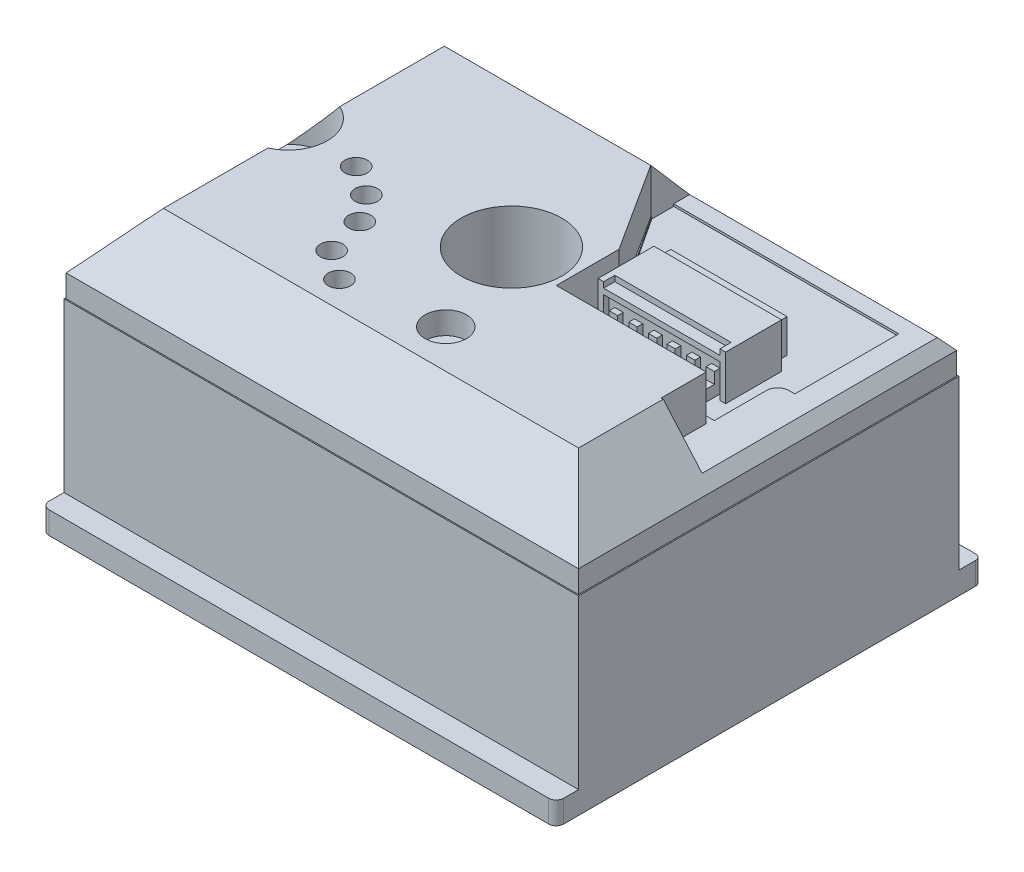
from build123d import *
from OCP.BRepFilletAPI import BRepFilletAPI_MakeChamfer

# Parameters (mm, degrees)
SKETCH1_W           = 46
SKETCH1_H           = 34
SKETCH1_R           = 4.5
BOSS_EXTRUDE1_DEPTH = 17
SKETCH2_W           = 45.8
SKETCH2_H           = 33.8
BOSS_EXTRUDE2_DEPTH = 2
SKETCH3_W           = 45.8
SKETCH3_H           = 33.8
BOSS_EXTRUDE3_DEPTH = 5
CHAMFER1_SIZE       = 5
CHAMFER1_SIZE2      = 4.346433689
SKETCH5_R           = 4.5
CUT_EXTRUDE1_DEPTH  = 63.032249677
CUT_EXTRUDE2_DEPTH  = 4
CUT_EXTRUDE3_DEPTH  = 4.5
CUT_EXTRUDE4_DEPTH  = 0.2
SKETCH11_W          = 11.4
SKETCH11_H          = 5
BOSS_EXTRUDE4_DEPTH = 4
SKETCH12_W          = 10.4
SKETCH12_H          = 1
CUT_EXTRUDE5_DEPTH  = 0.5
SKETCH13_W          = 10.4
SKETCH13_H          = 3
CUT_EXTRUDE6_DEPTH  = 0.5
SKETCH14_W          = 0.75
SKETCH14_H          = 2
BOSS_EXTRUDE5_DEPTH = 0.5
SKETCH15_W          = 0.75
SKETCH15_H          = 1
BOSS_EXTRUDE6_DEPTH = 1
SKETCH16_W          = 10.4
SKETCH16_H          = 3
BOSS_EXTRUDE7_DEPTH = 1
CUT_EXTRUDE7_DEPTH  = 1
SKETCH19_R          = 1
CUT_EXTRUDE8_DEPTH  = 2
SKETCH20_R          = 1.848835828
CUT_EXTRUDE9_DEPTH  = 2
BOSS_EXTRUDE8_DEPTH = 2
BOSS_EXTRUDE9_DEPTH = 2


with BuildPart() as part:
    # Sketch1 → Boss-Extrude1 (new body)
    with BuildSketch(Plane(origin=(0, 0, 0), x_dir=(1, 0, 0), z_dir=(0, 1, 0))):
        with Locations((23, 17)):
            Rectangle(SKETCH1_W, SKETCH1_H)
        with Locations(Location((23, 17, 0), (0, 0, 270))):
            Circle(SKETCH1_R, mode=Mode.SUBTRACT)
    extrude(amount=BOSS_EXTRUDE1_DEPTH)

    # Sketch2 → Boss-Extrude2 (add)
    with BuildSketch(Plane(origin=(0, 17, 0), x_dir=(1, 0, 0), z_dir=(0, 1, 0))):
        with Locations((23, 17)):
            Rectangle(SKETCH2_W, SKETCH2_H)
    extrude(amount=BOSS_EXTRUDE2_DEPTH)

    # Sketch3 → Boss-Extrude3 (add)
    with BuildSketch(Plane(origin=(0, 19, 0), x_dir=(1, 0, 0), z_dir=(0, 1, 0))):
        with Locations((23, 17)):
            Rectangle(SKETCH3_W, SKETCH3_H)
    extrude(amount=BOSS_EXTRUDE3_DEPTH)

    # Chamfer1: one chamfer whose edges measure the first distance from different faces: ONE call of the kernel's chamfer builder (chamfer() names one face for all edges)
    chamfer1_edges_1 = [part.edges().sort_by_distance(p)[0] for p in [
        (23, 24, -33.9),
    ]]
    chamfer1_side_1 = [part.faces().sort_by_distance(p)[0] for p in [
        (23, 20.5, -33.9),
    ]]
    chamfer1_edges_2 = [part.edges().sort_by_distance(p)[0] for p in [
        (0.1, 24, -17),
    ]]
    chamfer1_side_2 = [part.faces().sort_by_distance(p)[0] for p in [
        (0.1, 20.5, -17),
    ]]
    chamfer1_edges_3 = [part.edges().sort_by_distance(p)[0] for p in [
        (23, 24, -0.1),
    ]]
    chamfer1_side_3 = [part.faces().sort_by_distance(p)[0] for p in [
        (23, 20.5, -0.1),
    ]]
    chamfer1_edges_4 = [part.edges().sort_by_distance(p)[0] for p in [
        (45.9, 24, -17),
    ]]
    chamfer1_side_4 = [part.faces().sort_by_distance(p)[0] for p in [
        (45.9, 20.5, -17),
    ]]
    chamfer1 = BRepFilletAPI_MakeChamfer(part.part.solid().wrapped)
    for e in chamfer1_edges_1:
        chamfer1.Add(CHAMFER1_SIZE, CHAMFER1_SIZE2, e.wrapped, chamfer1_side_1[0].wrapped)  # the first distance lies on this face
    for e in chamfer1_edges_2:
        chamfer1.Add(CHAMFER1_SIZE, CHAMFER1_SIZE2, e.wrapped, chamfer1_side_2[0].wrapped)  # the first distance lies on this face
    for e in chamfer1_edges_3:
        chamfer1.Add(CHAMFER1_SIZE, CHAMFER1_SIZE2, e.wrapped, chamfer1_side_3[0].wrapped)  # the first distance lies on this face
    for e in chamfer1_edges_4:
        chamfer1.Add(CHAMFER1_SIZE, CHAMFER1_SIZE2, e.wrapped, chamfer1_side_4[0].wrapped)  # the first distance lies on this face
    add(Compound.cast(chamfer1.Shape()), mode=Mode.REPLACE)

    # Sketch5 → Cut-Extrude1 (cut, through all)
    with BuildSketch(Plane(origin=(0, 24, 0), x_dir=(1, 0, 0), z_dir=(0, 1, 0))):
        with Locations(Location((23, 17, 0), (0, 0, 270))):
            Circle(SKETCH5_R)
    extrude(amount=-CUT_EXTRUDE1_DEPTH, mode=Mode.SUBTRACT)

    # Sketch7 → Cut-Extrude2 (cut)
    with BuildSketch(Plane(origin=(0, 24, 0), x_dir=(1, 0, 0), z_dir=(0, 1, 0))):
        Polygon((41.375862069, 12.011652794), (41.553566311, 12.011652794), (41.553566311, 29.553566311), (22.9, 29.553566311), (27.975862069, 21.638287753), (27.975862069, 16.037336504), (41.375862069, 16.037336504), align=None)
        Polygon((45.9, 12.011652794), (45.9, 33.9), (22.9, 34), (22.9, 29.553566311), (41.553566311, 29.553566311), (41.553566311, 12.011652794), align=None)
    extrude(amount=-CUT_EXTRUDE2_DEPTH, mode=Mode.SUBTRACT)

    # Sketch9 → Cut-Extrude3 (cut)
    with BuildSketch(Plane(origin=(0, 24, 0), x_dir=(1, 0, 0), z_dir=(0, 1, 0))):
        with BuildLine():
            Line((0.1, 17), (0.1, 15.1))
            ThreePointArc((0.1, 15.1), (4.029878247, 13.643077531), (6.539387691, 17))
            Line((6.539387691, 17), (0.1, 17))
        make_face()
        with BuildLine():
            Line((0.1, 18.9), (0.1, 17))
            Line((0.1, 17), (6.539387691, 17))
            ThreePointArc((6.539387691, 17), (4.029878247, 20.356922469), (0.1, 18.9))
        make_face()
        with BuildLine():
            Line((0.1, 17), (0.1, 15.1))
            ThreePointArc((0.1, 15.1), (4.029878247, 13.643077531), (6.539387691, 17))
            Line((6.539387691, 17), (0.1, 17))
        make_face()
        with BuildLine():
            Line((0.1, 18.9), (0.1, 17))
            Line((0.1, 17), (6.539387691, 17))
            ThreePointArc((6.539387691, 17), (4.029878247, 20.356922469), (0.1, 18.9))
        make_face()
        with BuildLine():
            Line((0.1, 17), (0.1, 15.1))
            ThreePointArc((0.1, 15.1), (4.029878247, 13.643077531), (6.539387691, 17))
            Line((6.539387691, 17), (0.1, 17))
        make_face()
        with BuildLine():
            Line((0.1, 18.9), (0.1, 17))
            Line((0.1, 17), (6.539387691, 17))
            ThreePointArc((6.539387691, 17), (4.029878247, 20.356922469), (0.1, 18.9))
        make_face()
        with BuildLine():
            Line((0.1, 17), (0.1, 15.1))
            ThreePointArc((0.1, 15.1), (4.029878247, 13.643077531), (6.539387691, 17))
            Line((6.539387691, 17), (0.1, 17))
        make_face()
        with BuildLine():
            Line((0.1, 18.9), (0.1, 17))
            Line((0.1, 17), (6.539387691, 17))
            ThreePointArc((6.539387691, 17), (4.029878247, 20.356922469), (0.1, 18.9))
        make_face()
    extrude(amount=-CUT_EXTRUDE3_DEPTH, mode=Mode.SUBTRACT)

    # Sketch10 → Cut-Extrude4 (cut)
    with BuildSketch(Plane(origin=(0, 20, 0), x_dir=(1, 0, 0), z_dir=(0, 1, 0))):
        with BuildLine():
            Line((43.030713262, 22.3), (42.5, 22.3))
            ThreePointArc((42.5, 22.3), (41.792893219, 22.007106781), (41.5, 21.3))
            Line((41.5, 21.3), (41.5, 16.641494247))
            Line((41.5, 16.641494247), (28.1, 16.641494247))
            Line((28.1, 16.641494247), (28.1, 21.726215688))
            Line((28.1, 21.726215688), (22.9, 29.641494247))
            Line((22.9, 29.641494247), (22.9, 31.6))
            Line((22.9, 31.6), (43.030713262, 31.6))
            Line((43.030713262, 31.6), (43.030713262, 22.3))
        make_face()
    extrude(amount=-CUT_EXTRUDE4_DEPTH, mode=Mode.SUBTRACT)

    # Sketch11 → Boss-Extrude4 (add)
    with BuildSketch(Plane(origin=(0, 19.8, 0), x_dir=(1, 0, 0), z_dir=(0, 1, 0))):
        with Locations((34.8, 21.141494247)):
            Rectangle(SKETCH11_W, SKETCH11_H)
    extrude(amount=BOSS_EXTRUDE4_DEPTH)

    # Sketch12 → Cut-Extrude5 (cut)
    with BuildSketch(Plane(origin=(0, 23.8, 0), x_dir=(1, 0, 0), z_dir=(0, 1, 0))):
        with Locations((34.8, 19.141494247)):
            Rectangle(SKETCH12_W, SKETCH12_H)
    extrude(amount=-CUT_EXTRUDE5_DEPTH, mode=Mode.SUBTRACT)

    # Sketch13 → Cut-Extrude6 (cut)
    with BuildSketch(Plane.XY.offset(-18.641494247)):
        with Locations((34.8, 21.3)):
            Rectangle(SKETCH13_W, SKETCH13_H)
    extrude(amount=-CUT_EXTRUDE6_DEPTH, mode=Mode.SUBTRACT)

    # Sketch14 → Boss-Extrude5 (add)
    with BuildSketch(Plane.XY.offset(-19.141494247)):
        with Locations((30.475, 20.8)):
            Rectangle(SKETCH14_W, SKETCH14_H)
        with Locations((32.225, 20.8)):
            Rectangle(SKETCH14_W, SKETCH14_H)
        with Locations((33.975, 20.8)):
            Rectangle(SKETCH14_W, SKETCH14_H)
        with Locations((35.625, 20.8)):
            Rectangle(SKETCH14_W, SKETCH14_H)
        with Locations((37.375, 20.8)):
            Rectangle(SKETCH14_W, SKETCH14_H)
        with Locations((39.125, 20.8)):
            Rectangle(SKETCH14_W, SKETCH14_H)
    extrude(amount=BOSS_EXTRUDE5_DEPTH)

    # Sketch15 → Boss-Extrude6 (add)
    with BuildSketch(Plane.XY.offset(-18.641494247)):
        with Locations((30.475, 20.3)):
            Rectangle(SKETCH15_W, SKETCH15_H)
        with Locations((32.225, 20.3)):
            Rectangle(SKETCH15_W, SKETCH15_H)
        with Locations((33.975, 20.3)):
            Rectangle(SKETCH15_W, SKETCH15_H)
        with Locations((35.625, 20.3)):
            Rectangle(SKETCH15_W, SKETCH15_H)
        with Locations((37.375, 20.3)):
            Rectangle(SKETCH15_W, SKETCH15_H)
        with Locations((39.125, 20.3)):
            Rectangle(SKETCH15_W, SKETCH15_H)
    extrude(amount=BOSS_EXTRUDE6_DEPTH)

    # Sketch16 → Boss-Extrude7 (add)
    with BuildSketch(Plane(origin=(0, 0, -23.641494247), x_dir=(-1, 0, 0), z_dir=(0, 0, -1))):
        with Locations((-34.8, 21.8)):
            Rectangle(SKETCH16_W, SKETCH16_H)
    extrude(amount=BOSS_EXTRUDE7_DEPTH)

    # Sketch18 → Cut-Extrude7 (cut)
    with BuildSketch(Plane(origin=(0, 0, -24.641494247), x_dir=(-1, 0, 0), z_dir=(0, 0, -1))):
        Polygon((-38.5, 22.851547848), (-37.641246713, 22.851547848), (-37.641246713, 21.62271547), (-37.883028636, 21.62271547), (-37.883028636, 21.05), (-38.258218077, 21.05), (-38.258218077, 21.62271547), (-38.5, 21.62271547), align=None)
        Polygon((-35.782493426, 22.851547848), (-34.923740138, 22.851547848), (-34.923740138, 21.62271547), (-35.165522062, 21.62271547), (-35.165522062, 21.05), (-35.540711502, 21.05), (-35.540711502, 21.62271547), (-35.782493426, 21.62271547), align=None)
        Polygon((-37.141246713, 22.851547848), (-36.282493426, 22.851547848), (-36.282493426, 21.62271547), (-36.524275349, 21.62271547), (-36.524275349, 21.05), (-36.89946479, 21.05), (-36.89946479, 21.62271547), (-37.141246713, 21.62271547), align=None)
        Polygon((-34.423740138, 22.851547848), (-33.564986851, 22.851547848), (-33.564986851, 21.62271547), (-33.806768774, 21.62271547), (-33.806768774, 21.05), (-34.181958215, 21.05), (-34.181958215, 21.62271547), (-34.423740138, 21.62271547), align=None)
        Polygon((-33.064986851, 22.851547848), (-32.206233564, 22.851547848), (-32.206233564, 21.62271547), (-32.448015487, 21.62271547), (-32.448015487, 21.05), (-32.823204928, 21.05), (-32.823204928, 21.62271547), (-33.064986851, 21.62271547), align=None)
        Polygon((-31.706233564, 22.851547848), (-30.847480277, 22.851547848), (-30.847480277, 21.62271547), (-31.0892622, 21.62271547), (-31.0892622, 21.05), (-31.464451641, 21.05), (-31.464451641, 21.62271547), (-31.706233564, 21.62271547), align=None)
    extrude(amount=-CUT_EXTRUDE7_DEPTH, mode=Mode.SUBTRACT)

    # Sketch19 → Cut-Extrude8 (cut)
    with BuildSketch(Plane(origin=(0, 24, 0), x_dir=(1, 0, 0), z_dir=(0, 1, 0))):
        with Locations(Location((9.822889118, 16.294475275, 0), (0, 0, 270))):
            Circle(SKETCH19_R)
        with Locations(Location((12.479656801, 14.55031441, 0), (0, 0, 270))):
            Circle(SKETCH19_R)
        with Locations(Location((14.248903695, 12.19430902, 0), (0, 0, 270))):
            Circle(SKETCH19_R)
        with Locations(Location((15.225409883, 8.704826885, 0), (0, 0, 270))):
            Circle(SKETCH19_R)
        with Locations(Location((17.811892688, 6.813228664, 0), (0, 0, 270))):
            Circle(SKETCH19_R)
    extrude(amount=-CUT_EXTRUDE8_DEPTH, mode=Mode.SUBTRACT)

    # Sketch20 → Cut-Extrude9 (cut)
    with BuildSketch(Plane(origin=(0, 24, 0), x_dir=(1, 0, 0), z_dir=(0, 1, 0))):
        with Locations(Location((26.228756872, 7.901616706, 0), (0, 0, 270))):
            Circle(SKETCH20_R)
    extrude(amount=-CUT_EXTRUDE9_DEPTH, mode=Mode.SUBTRACT)

    # Sketch21 → Boss-Extrude8 (add)
    with BuildSketch(Plane.XZ):
        with BuildLine():
            Line((46, -34), (22.948134598, -34))
            Line((22.948134598, -34), (22.948134598, -35.5))
            ThreePointArc((22.948134598, -35.5), (23.094581208, -35.853553391), (23.448134598, -36))
            Line((23.448134598, -36), (45.5, -36))
            ThreePointArc((45.5, -36), (45.853553391, -35.853553391), (46, -35.5))
            Line((46, -35.5), (46, -34))
        make_face()
    extrude(amount=-BOSS_EXTRUDE8_DEPTH)

    # Sketch22 → Boss-Extrude9 (add)
    with BuildSketch(Plane.XZ):
        with BuildLine():
            Line((46, 0), (0, 0))
            Line((0, 0), (0, 1.328354237))
            ThreePointArc((0, 1.328354237), (0.196720489, 1.803279511), (0.671645763, 2))
            Line((0.671645763, 2), (45.328354237, 2))
            ThreePointArc((45.328354237, 2), (45.803279511, 1.803279511), (46, 1.328354237))
            Line((46, 1.328354237), (46, 0))
        make_face()
    extrude(amount=-BOSS_EXTRUDE9_DEPTH)


solid = part.part
